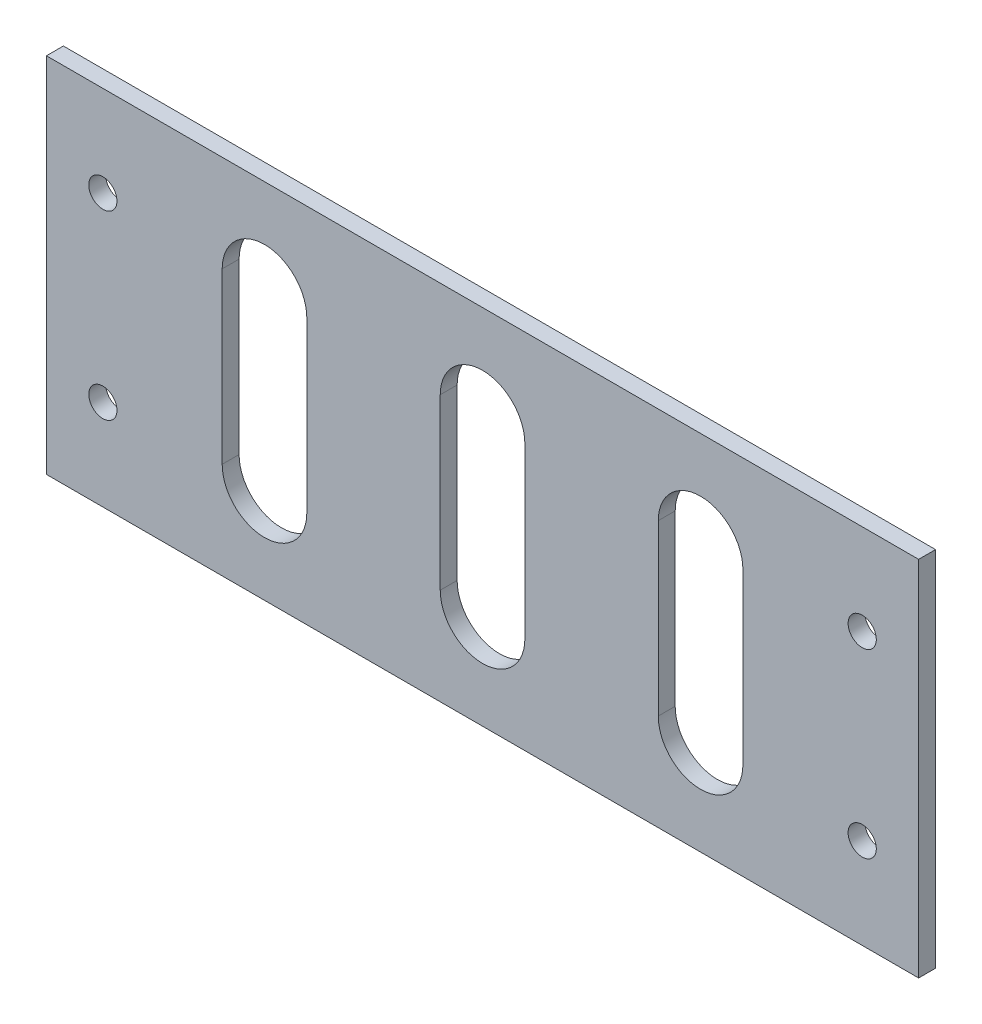
from build123d import *

# Parameters (mm, degrees)
ESQUISSE2_W             = 154.6
ESQUISSE2_H             = 3
BOSS_EXTRU_1_DEPTH      = 64.27
ESQUISSE3_R             = 2.5
ENL_V_MAT_EXTRU_1_DEPTH = 101.761443216
ENL_V_MAT_EXTRU_2_DEPTH = 101.761443216


with BuildPart() as part:
    # Esquisse2 → Boss.-Extru.1 (new body)
    with BuildSketch(Plane(origin=(0, 0, 0), x_dir=(1, 0, 0), z_dir=(0, 1, 0))):
        with Locations((-0.245054897, 0)):
            Rectangle(ESQUISSE2_W, ESQUISSE2_H)
    extrude(amount=BOSS_EXTRU_1_DEPTH)

    # Esquisse3 → Enlèv. mat.-Extru.1 (cut, through all)
    with BuildSketch(Plane.XY.offset(1.5)):
        with Locations((-67.545054897, 16.0675)):
            Circle(ESQUISSE3_R)
        with Locations((-67.545054897, 48.2025)):
            Circle(ESQUISSE3_R)
        with Locations((67.054945103, 48.2025)):
            Circle(ESQUISSE3_R)
        with Locations((67.054945103, 16.0675)):
            Circle(ESQUISSE3_R)
    extrude(amount=-ENL_V_MAT_EXTRU_1_DEPTH, mode=Mode.SUBTRACT)

    # Esquisse4 → Enlèv. mat.-Extru.2 (cut, through all)
    with BuildSketch(Plane.XY.offset(1.5)):
        with BuildLine():
            Line((-46.395054897, 47.135), (-46.395054897, 17.135))
            ThreePointArc((-46.395054897, 17.135), (-38.895054897, 9.635), (-31.395054897, 17.135))
            Line((-31.395054897, 17.135), (-31.395054897, 47.135))
            ThreePointArc((-31.395054897, 47.135), (-38.895054897, 54.635), (-46.395054897, 47.135))
        make_face()
        with BuildLine():
            Line((-7.745054897, 47.135), (-7.745054897, 17.135))
            ThreePointArc((-7.745054897, 17.135), (-0.245054897, 9.635), (7.254945103, 17.135))
            Line((7.254945103, 17.135), (7.254945103, 47.135))
            ThreePointArc((7.254945103, 47.135), (-0.245054897, 54.635), (-7.745054897, 47.135))
        make_face()
        with BuildLine():
            Line((30.904945103, 47.135), (30.904945103, 17.135))
            ThreePointArc((30.904945103, 17.135), (38.404945103, 9.635), (45.904945103, 17.135))
            Line((45.904945103, 17.135), (45.904945103, 47.135))
            ThreePointArc((45.904945103, 47.135), (38.404945103, 54.635), (30.904945103, 47.135))
        make_face()
    extrude(amount=-ENL_V_MAT_EXTRU_2_DEPTH, mode=Mode.SUBTRACT)


solid = part.part
